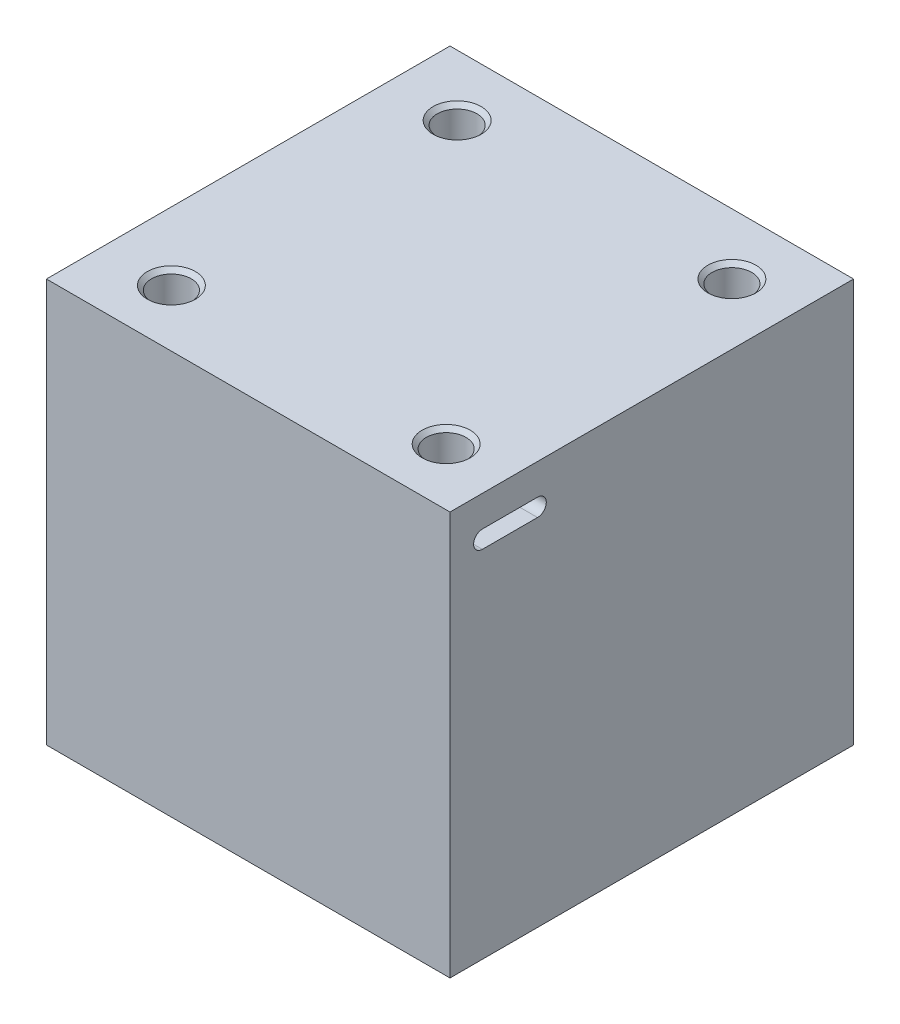
from build123d import *

# Parameters (mm, degrees)
ESQUISSE1_W                 = 50.8
ESQUISSE1_H                 = 50.8
BOSS_EXTRU_1_DEPTH          = 50.8
TROU_TARAUD_M61_D           = 5
TROU_TARAUD_M61_CSINK_D     = 6.05
TROU_TARAUD_M61_CSINK_ANGLE = 90
ENL_V_MAT_EXTRU_2_REACH     = 89.988


with BuildPart() as part:
    # Esquisse1 → Boss.-Extru.1 (new body)
    with BuildSketch(Plane.XY):
        with Locations((-25.4, 25.4)):
            Rectangle(ESQUISSE1_W, ESQUISSE1_H)
    extrude(amount=BOSS_EXTRU_1_DEPTH)

    # Trou taraudé M61 (through all)
    with Locations(Plane(origin=(0, 50.8, 0), x_dir=(1, 0, 0), z_dir=(0, 1, 0))):
        with Locations((-42.238223885, -7.663368272), (-7.652573676, -7.663368272), (-7.652573676, -43.63244449), (-42.238223885, -43.63244449)):
            CounterSinkHole(TROU_TARAUD_M61_D / 2, TROU_TARAUD_M61_CSINK_D / 2, counter_sink_angle=TROU_TARAUD_M61_CSINK_ANGLE)

    # Esquisse4 → Enlèv. mat.-Extru.2 (cut, up to next)
    with BuildSketch(Plane(origin=(0, 0, 0), x_dir=(0, 0, -1), z_dir=(1, 0, 0)), mode=Mode.PRIVATE) as enl_v_mat_extru_2_sk1:
        with BuildLine():
            Line((-46.721032859, 46.906628003), (-39.78616404, 46.906628003))
            ThreePointArc((-39.78616404, 46.906628003), (-38.679536037, 45.8), (-39.78616404, 44.693371997))
            Line((-39.78616404, 44.693371997), (-46.721032859, 44.693371997))
            ThreePointArc((-46.721032859, 44.693371997), (-47.827660862, 45.8), (-46.721032859, 46.906628003))
        make_face()
    enl_v_mat_extru_2_tool1 = extrude(enl_v_mat_extru_2_sk1.sketch, amount=-ENL_V_MAT_EXTRU_2_REACH, mode=Mode.PRIVATE) & part.part
    add(enl_v_mat_extru_2_tool1.solids().sort_by_distance((0, 45.8, 43.253598))[0], mode=Mode.SUBTRACT)


solid = part.part
